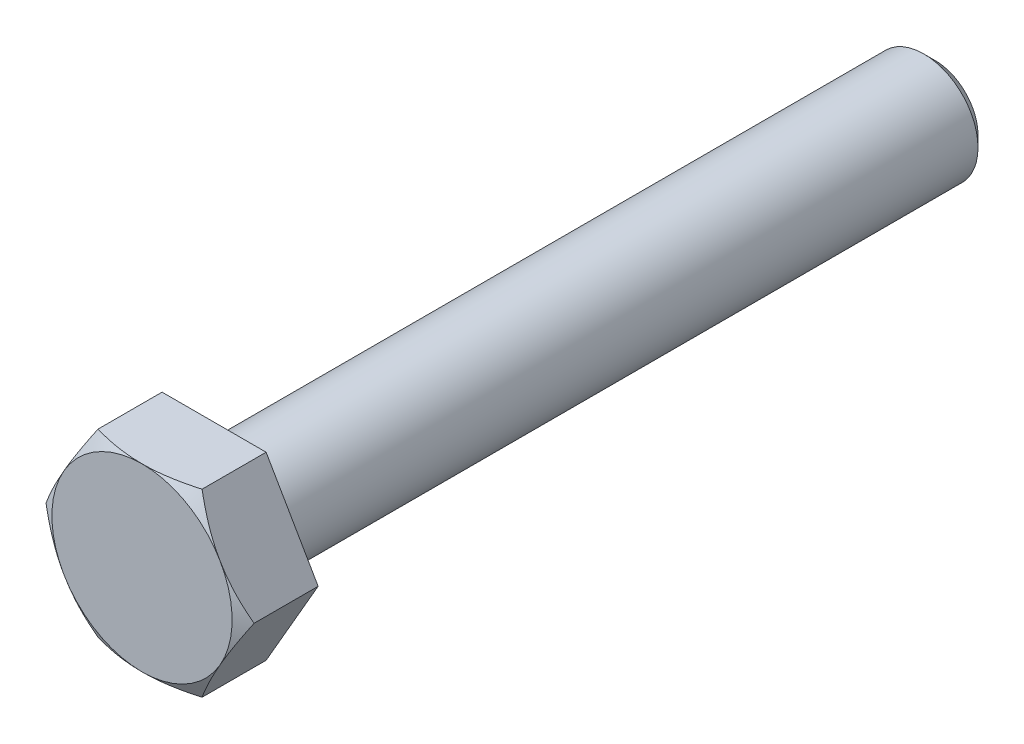
from build123d import *

# Parameters (mm, degrees)
BASE_EXTRUDE_DEPTH  = 4
SKETCH3_R           = 3
BOSS_EXTRUDE1_DEPTH = 40
CHAMFER1_SIZE       = 0.6134
FILLET1_R           = 0.25


with BuildPart() as part:
    # Sketch1 → Base-Extrude (new body)
    with BuildSketch(Plane.XY):
        Polygon((-2.886751346, 5), (2.886751346, 5), (5.773502692, 0), (2.886751346, -5), (-2.886751346, -5), (-5.773502692, 0), align=None)
    extrude(amount=BASE_EXTRUDE_DEPTH)

    # Sketch5 → Cut-Revolve1 (revolve, cut)
    with BuildSketch(Plane(origin=(0, 0, 0), x_dir=(1, 0, 0), z_dir=(0, 1, 0))):
        Polygon((-5.773502692, -4), (-5, -4), (-5.773502692, -3.553418013), align=None)
    revolve(axis=Axis((0, 0, 0), (0, 0, 1)), mode=Mode.SUBTRACT)

    # Sketch3 → Boss-Extrude1 (add)
    with BuildSketch(Plane(origin=(0, 0, 0), x_dir=(-1, 0, 0), z_dir=(0, 0, -1))):
        with Locations(Location((0, 0, 0), (0, 0, 180))):
            Circle(SKETCH3_R)
    extrude(amount=BOSS_EXTRUDE1_DEPTH)

    # Chamfer1
    chamfer1_edges = [part.edges().sort_by_distance(p)[0] for p in [
        (-3, 0, -40),
    ]]
    chamfer(chamfer1_edges, length=CHAMFER1_SIZE)

    # Fillet1
    fillet1_edges = [part.edges().sort_by_distance(p)[0] for p in [
        (-3, 0, 0),
    ]]
    fillet(fillet1_edges, radius=FILLET1_R)


solid = part.part
